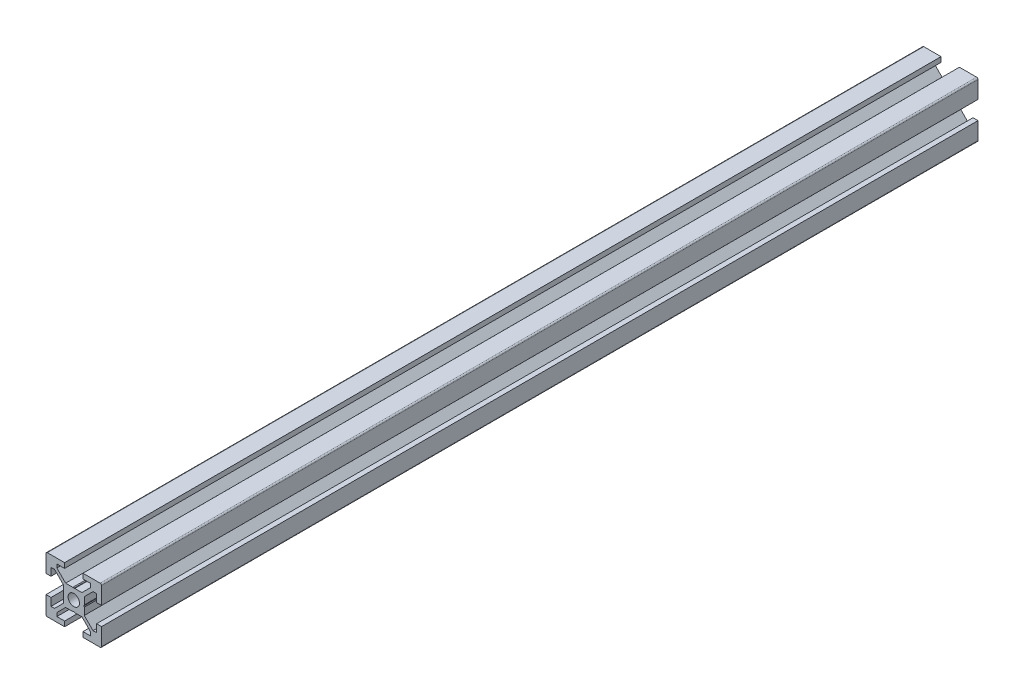
from build123d import *

# Parameters (mm, degrees)
SKETCH1_R            = 2.05
BOSS_EXTRUDE1_DEPTH  = 157.75
FILLET1_R            = 0.5
FILLET1_OF_MIRROR2_R = 0.5


with BuildPart() as part:
    # Sketch1 → Boss-Extrude1 (new body)
    with BuildSketch(Plane.XY):
        Polygon((-3.3, 10), (-3.3, 8.2), (-6.08, 8.2), (-6.08, 6.928528137), (-2.931471863, 3.78), (-0.34, 3.78), (0, 3.66), (0.34, 3.78), (2.931471863, 3.78), (6.08, 6.928528137), (6.08, 8.2), (3.3, 8.2), (3.3, 10), (10, 10), (10, 3.3), (8.2, 3.3), (8.2, 6.08), (6.928528137, 6.08), (3.78, 2.931471863), (3.78, 0.34), (3.66, 0), (3.78, -0.34), (3.78, -2.931471863), (6.928528137, -6.08), (8.2, -6.08), (8.2, -3.3), (10, -3.3), (10, -10), (3.3, -10), (3.3, -8.2), (6.08, -8.2), (6.08, -6.928528137), (2.931471863, -3.78), (0.34, -3.78), (0, -3.66), (-0.34, -3.78), (-2.931471863, -3.78), (-6.08, -6.928528137), (-6.08, -8.2), (-3.3, -8.2), (-3.3, -10), (-10, -10), (-10, -3.3), (-8.2, -3.3), (-8.2, -6.08), (-6.928528137, -6.08), (-3.78, -2.931471863), (-3.78, -0.34), (-3.66, 0), (-3.78, 0.34), (-3.78, 2.931471863), (-6.928528137, 6.08), (-8.2, 6.08), (-8.2, 3.3), (-10, 3.3), (-10, 10), align=None)
        Circle(SKETCH1_R, mode=Mode.SUBTRACT)
    boss_extrude1 = extrude(amount=BOSS_EXTRUDE1_DEPTH)

    # Fillet1
    fillet1_edges = [part.edges().sort_by_distance(p)[0] for p in [
        (10, 10, 78.875),
        (10, -10, 78.875),
        (-10, -10, 78.875),
        (-10, 10, 78.875),
    ]]
    fillet(fillet1_edges, radius=FILLET1_R)

    # Mirror2: Boss-Extrude1 across plane
    add(boss_extrude1.mirror(Plane.XY.offset(157.75)))

    # Fillet1 of Mirror2
    fillet1_of_mirror2_edges = [part.edges().sort_by_distance(p)[0] for p in [
        (10, 10, 236.625),
        (10, -10, 236.625),
        (-10, -10, 236.625),
        (-10, 10, 236.625),
    ]]
    fillet(fillet1_of_mirror2_edges, radius=FILLET1_OF_MIRROR2_R)


solid = part.part
